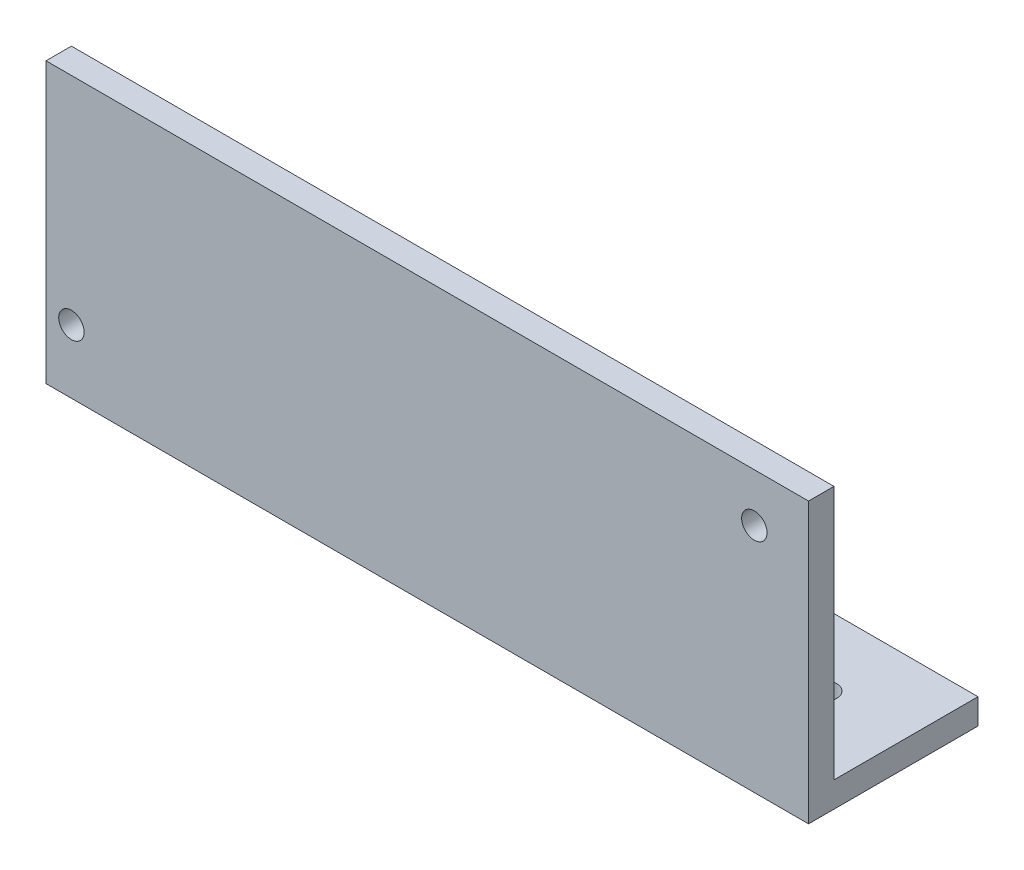
from build123d import *

# Parameters (mm, degrees)
SKETCH1_W           = 90
SKETCH1_H           = 20
SKETCH1_R           = 1.5
BOSS_EXTRUDE1_DEPTH = 3
SKETCH2_W           = 90
SKETCH2_H           = 30
SKETCH2_R           = 1.5
BOSS_EXTRUDE2_DEPTH = 3


with BuildPart() as part:
    # Sketch1 → Boss-Extrude1 (new body)
    with BuildSketch(Plane(origin=(0, 0, 0), x_dir=(1, 0, 0), z_dir=(0, 1, 0))):
        with Locations((31.143497758, 2.511210762)):
            Rectangle(SKETCH1_W, SKETCH1_H)
        with Locations(Location((-6.338089317, 4.011210762, 0), (0, 0, 270))):
            Circle(SKETCH1_R, mode=Mode.SUBTRACT)
        with Locations(Location((66.470970633, 4.011210762, 0), (0, 0, 270))):
            Circle(SKETCH1_R, mode=Mode.SUBTRACT)
    extrude(amount=BOSS_EXTRUDE1_DEPTH)

    # Sketch2 → Boss-Extrude2 (add)
    with BuildSketch(Plane.XY.offset(7.488789238)):
        with Locations((31.143497758, 18)):
            Rectangle(SKETCH2_W, SKETCH2_H)
        with Locations((-10.856502242, 7.5)):
            Circle(SKETCH2_R, mode=Mode.SUBTRACT)
        with Locations((69.743497758, 27.3)):
            Circle(SKETCH2_R, mode=Mode.SUBTRACT)
    extrude(amount=-BOSS_EXTRUDE2_DEPTH)


solid = part.part
